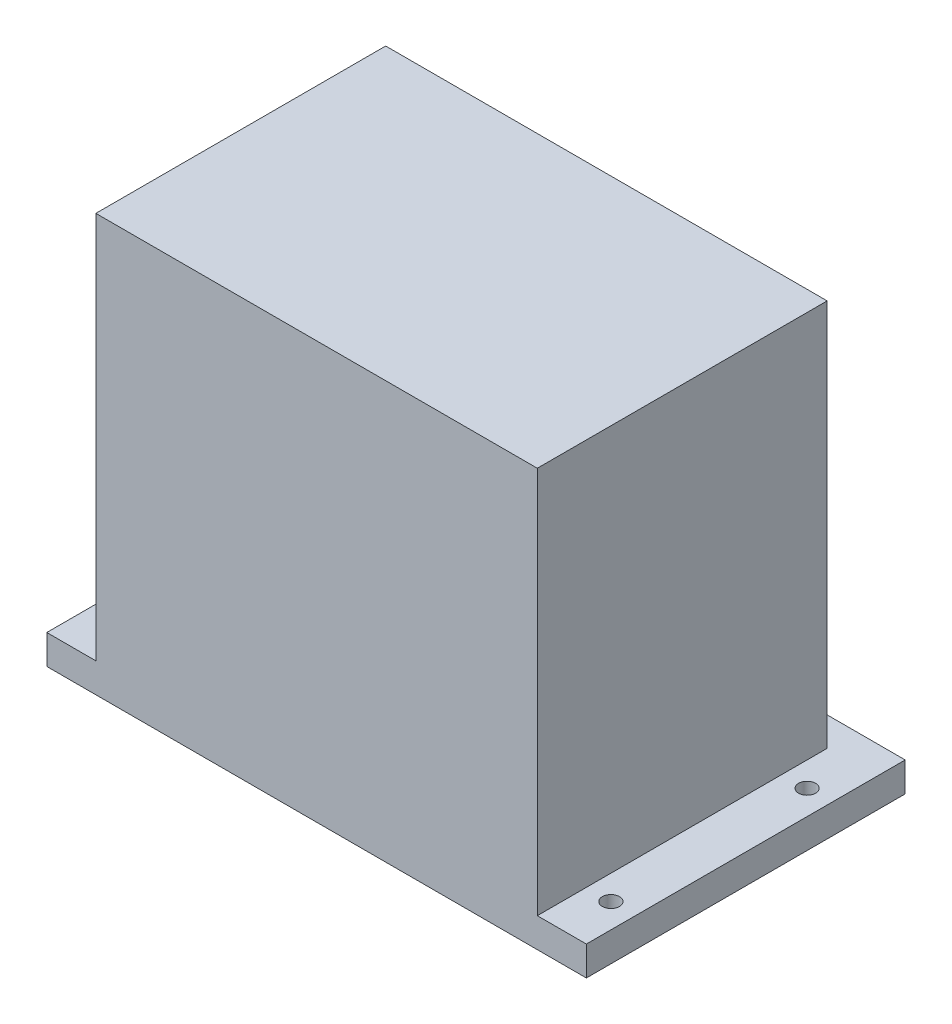
from build123d import *

# Parameters (mm, degrees)
SKETCH1_R           = 1.75
BOSS_EXTRUDE1_DEPTH = 6
SKETCH1_3_W         = 90
SKETCH1_3_H         = 59.090909091
BOSS_EXTRUDE2_DEPTH = 85


with BuildPart() as part:
    # Sketch1 → Boss-Extrude1 (new body)
    with BuildSketch(Plane(origin=(0, 0, 0), x_dir=(1, 0, 0), z_dir=(0, 1, 0))):
        Polygon((-35, 27.5), (-35, 32.5), (-55, 32.5), (-55, -32.5), (-45, -32.5), (-45, 26.590909091), (45, 26.590909091), (45, -32.5), (55, -32.5), (55, 32.5), (35, 32.5), (35, 27.5), (15, 27.5), (15, 32.5), (-15, 32.5), (-15, 27.5), align=None)
        with Locations((-50, -22.5)):
            Circle(SKETCH1_R, mode=Mode.SUBTRACT)
        with Locations((50, -22.5)):
            Circle(SKETCH1_R, mode=Mode.SUBTRACT)
        with Locations((-50, 17.5)):
            Circle(SKETCH1_R, mode=Mode.SUBTRACT)
        with Locations((50, 17.5)):
            Circle(SKETCH1_R, mode=Mode.SUBTRACT)
    extrude(amount=BOSS_EXTRUDE1_DEPTH)

    # Sketch1<3> → Boss-Extrude2 (add)
    with BuildSketch(Plane(origin=(0, 0, 0), x_dir=(1, 0, 0), z_dir=(0, 1, 0))):
        with Locations((0, -2.954545454)):
            Rectangle(SKETCH1_3_W, SKETCH1_3_H)
    extrude(amount=BOSS_EXTRUDE2_DEPTH)


solid = part.part
